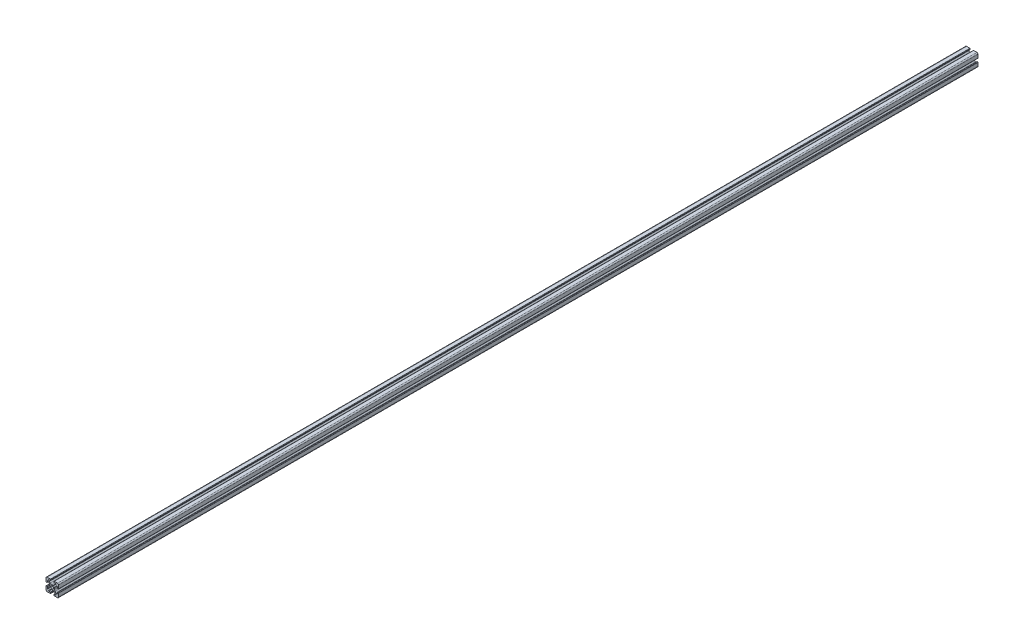
from build123d import *

# Parameters (mm, degrees)
BOSS_EXTRUDE1_DEPTH = 730.72


with BuildPart() as part:
    # Sketch4 → Boss-Extrude1 (new, symmetric)
    with BuildSketch(Plane.XY):
        with BuildLine():
            Line((3, -10), (8.25, -10))
            ThreePointArc((8.25, -10), (9.487436867, -9.487436867), (10, -8.25))
            Line((10, -8.25), (10, -3))
            ThreePointArc((10, -3), (9.853553391, -2.646446609), (9.5, -2.5))
            Line((9.5, -2.5), (8.424621202, -2.5))
            ThreePointArc((8.424621202, -2.5), (8.071067812, -2.646446609), (7.924621202, -3))
            Line((7.924621202, -3), (7.924621202, -5.25))
            ThreePointArc((7.924621202, -5.25), (7.615962919, -5.711939766), (7.071067812, -5.603553391))
            Line((7.071067812, -5.603553391), (4.478679656, -3.011165235))
            ThreePointArc((4.478679656, -3.011165235), (3.828361402, -2.037895189), (3.6, -0.889844892))
            Line((3.6, -0.889844892), (3.6, 0))
            Line((3.6, 0), (2.15, 0))
            ThreePointArc((2.15, 0), (1.52027958, -1.52027958), (0, -2.15))
            Line((0, -2.15), (0, -3.6))
            Line((0, -3.6), (0.889844892, -3.6))
            ThreePointArc((0.889844892, -3.6), (2.037895189, -3.828361402), (3.011165235, -4.478679656))
            Line((3.011165235, -4.478679656), (5.603553391, -7.071067812))
            ThreePointArc((5.603553391, -7.071067812), (5.711939766, -7.615962919), (5.25, -7.924621202))
            Line((5.25, -7.924621202), (3, -7.924621202))
            ThreePointArc((3, -7.924621202), (2.646446609, -8.071067812), (2.5, -8.424621202))
            Line((2.5, -8.424621202), (2.5, -9.5))
            ThreePointArc((2.5, -9.5), (2.646446609, -9.853553391), (3, -10))
        make_face()
    extrude(amount=BOSS_EXTRUDE1_DEPTH, both=True)

    # Mirror1: part across plane


with BuildPart() as part_1:
    add(part.part)
    add(part.part.mirror(Plane(origin=(0, 0, 0), x_dir=(0, 0, 1), z_dir=(1, 0, 0))))

    # Mirror2: part across plane


with BuildPart() as part_2:
    add(part_1.part)
    add(part_1.part.mirror(Plane.ZX))


solid = part_2.part
